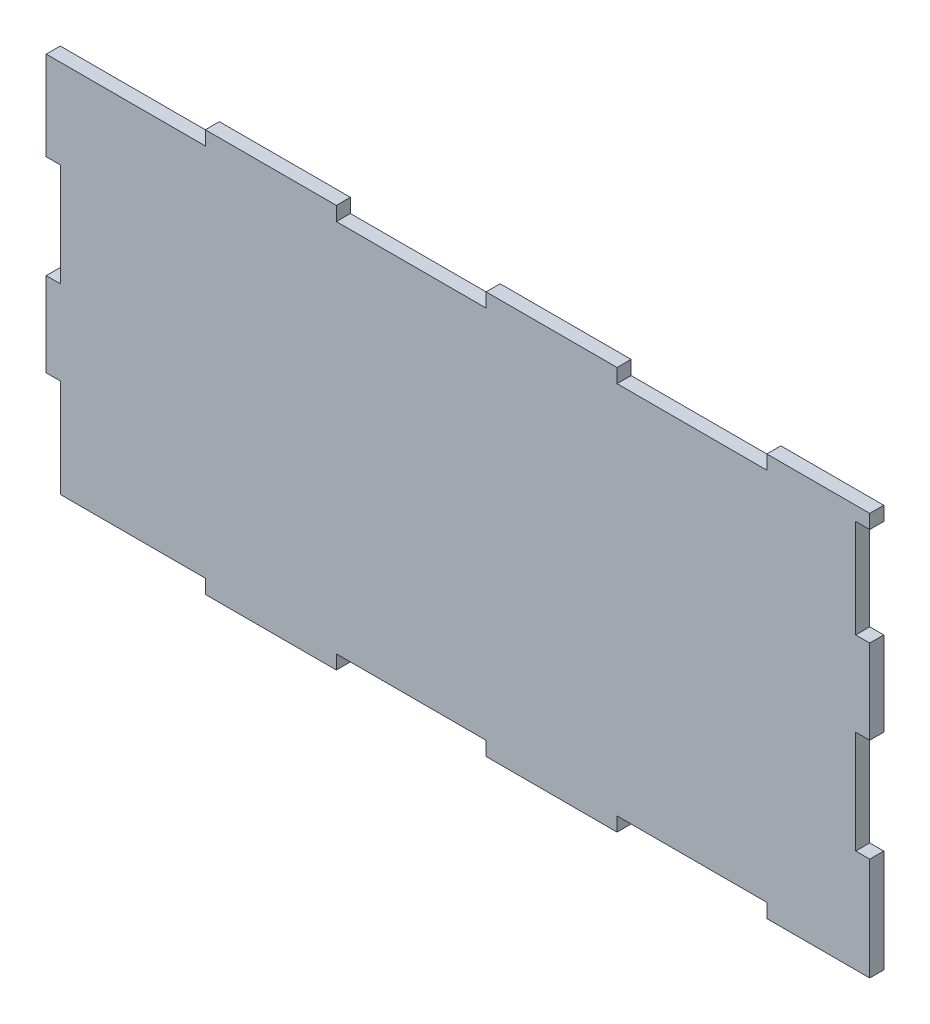
from build123d import *

# Parameters (mm, degrees)
ESQUISSE1_W             = 170
ESQUISSE1_H             = 80
BOSS_EXTRU_1_DEPTH      = 3
ESQUISSE3_W             = 28
ESQUISSE3_H             = 3
ESQUISSE3_W_2           = 22
BOSS_EXTRU_2_DEPTH      = 3
ESQUISSE4_W             = 3
ESQUISSE4_H             = 19
ESQUISSE4_H_2           = 18
ESQUISSE4_H_3           = 19.233956883
BOSS_EXTRU_3_DEPTH      = 3
ESQUISSE5_W             = 3.071340823
ESQUISSE5_H             = 0.315544452
ENL_V_MAT_EXTRU_1_DEPTH = 3


with BuildPart() as part:
    # Esquisse1 → Boss.-Extru.1 (new body)
    with BuildSketch(Plane.XY):
        with Locations((40.41093995, 17.47440273)):
            Rectangle(ESQUISSE1_W, ESQUISSE1_H)
    extrude(amount=BOSS_EXTRU_1_DEPTH)

    # Esquisse3 → Boss.-Extru.2 (add)
    with BuildSketch(Plane(origin=(0, 0, 0), x_dir=(-1, 0, 0), z_dir=(0, 0, -1))):
        with Locations((-0.41093995, 58.97440273)):
            Rectangle(ESQUISSE3_W, ESQUISSE3_H)
        with Locations((-60.41093995, 58.97440273)):
            Rectangle(ESQUISSE3_W, ESQUISSE3_H)
        with Locations((-117.41093995, 58.97440273)):
            Rectangle(ESQUISSE3_W_2, ESQUISSE3_H)
        with Locations((-117.41093995, -24.02559727)):
            Rectangle(ESQUISSE3_W_2, ESQUISSE3_H)
        with Locations((-60.41093995, -24.02559727)):
            Rectangle(ESQUISSE3_W, ESQUISSE3_H)
        with Locations((-0.41093995, -24.02559727)):
            Rectangle(ESQUISSE3_W, ESQUISSE3_H)
    extrude(amount=-BOSS_EXTRU_2_DEPTH)

    # Esquisse4 → Boss.-Extru.3 (add)
    with BuildSketch(Plane.XY.offset(3)):
        with Locations((126.91093995, -13.02559727)):
            Rectangle(ESQUISSE4_W, ESQUISSE4_H)
        with Locations((126.91093995, 27.47440273)):
            Rectangle(ESQUISSE4_W, ESQUISSE4_H_2)
        with Locations((-46.08906005, 48.091381172)):
            Rectangle(ESQUISSE4_W, ESQUISSE4_H_3)
        with Locations((-46.08906005, 7.47440273)):
            Rectangle(ESQUISSE4_W, ESQUISSE4_H_2)
    extrude(amount=-BOSS_EXTRU_3_DEPTH)

    # Esquisse5 → Enlèv. mat.-Extru.1 (cut)
    with BuildSketch(Plane(origin=(0, 0, 0), x_dir=(-1, 0, 0), z_dir=(0, 0, -1))):
        with Locations((46.124730462, 57.632174956)):
            Rectangle(ESQUISSE5_W, ESQUISSE5_H)
    extrude(amount=-ENL_V_MAT_EXTRU_1_DEPTH, mode=Mode.SUBTRACT)


solid = part.part
